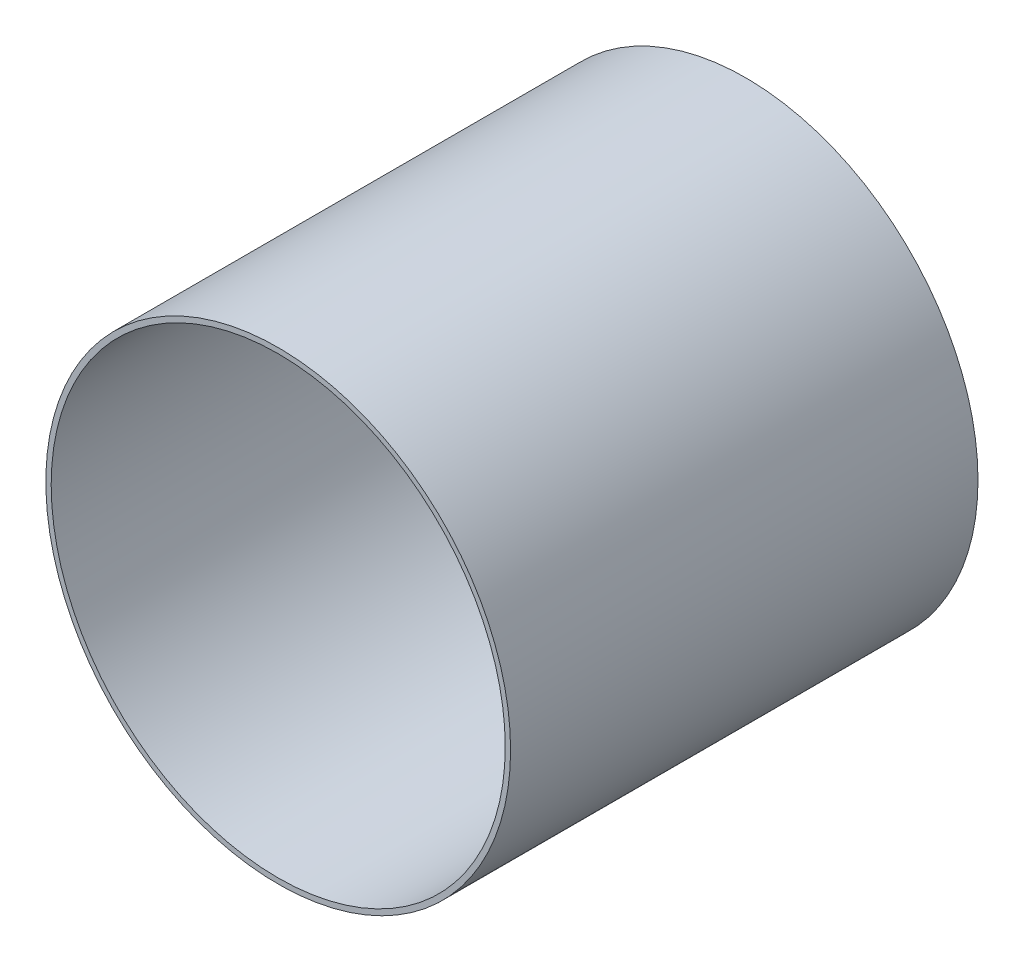
from build123d import *

# Parameters (mm, degrees)
SKETCH1_R           = 43.5
SKETCH1_R_2         = 42.5
BOSS_EXTRUDE1_DEPTH = 87.5


with BuildPart() as part:
    # Sketch1 → Boss-Extrude1 (new body)
    with BuildSketch(Plane.XY):
        Circle(SKETCH1_R)
        Circle(SKETCH1_R_2, mode=Mode.SUBTRACT)
    extrude(amount=BOSS_EXTRUDE1_DEPTH)


solid = part.part
